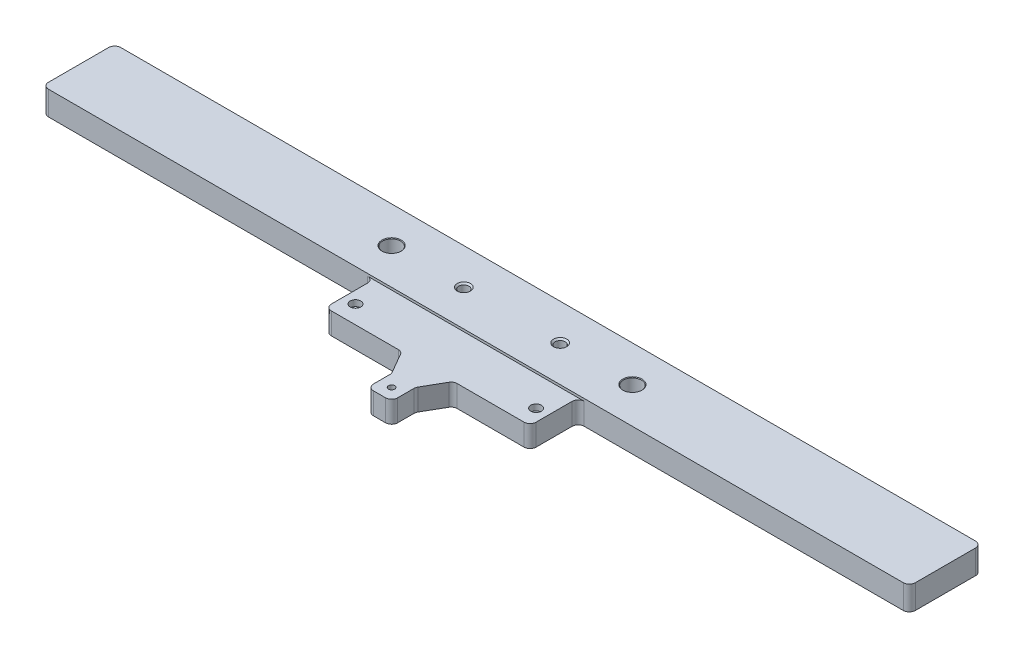
from build123d import *

# Parameters (mm, degrees)
SKETCH1_W                                        = 914.4
SKETCH1_H                                        = 76.2
BOSS_EXTRUDE1_DEPTH                              = 25.4
FILLET1_R                                        = 6.35
F_3_4_0_7500_DOWEL_HOLE1_D                       = 19.05
F_3_4_0_7500_DOWEL_HOLE1_CSINK_D                 = 20.32
F_3_4_0_7500_DOWEL_HOLE1_CSINK_ANGLE             = 90
BOSS_EXTRUDE2_DEPTH                              = 22.86
FILLET2_R                                        = 6.35
F_5_16_18_TAPPED_HOLE1_D                         = 6.5278
F_1_2_13_TAPPED_HOLE1_D                          = 10.71626
F_1_2_13_TAPPED_HOLE1_CSINK_D                    = 13.97
F_1_2_13_TAPPED_HOLE1_CSINK_ANGLE                = 90
CBORE_FOR_1_4_SOCKET_HEAD_CAP_SCREW1_D           = 6.7564
CBORE_FOR_1_4_SOCKET_HEAD_CAP_SCREW1_CBORE_D     = 11.1125
CBORE_FOR_1_4_SOCKET_HEAD_CAP_SCREW1_CBORE_DEPTH = 6.35


with BuildPart() as part:
    # Sketch1 → Boss-Extrude1 (new body)
    with BuildSketch(Plane(origin=(0, 0, 0), x_dir=(1, 0, 0), z_dir=(0, 1, 0))):
        Rectangle(SKETCH1_W, SKETCH1_H)
    extrude(amount=BOSS_EXTRUDE1_DEPTH)

    # Fillet1
    fillet1_edges = [part.edges().sort_by_distance(p)[0] for p in [
        (457.2, 12.7, 38.1),
        (-457.2, 12.7, 38.1),
        (-457.2, 12.7, -38.1),
        (457.2, 12.7, -38.1),
    ]]
    fillet(fillet1_edges, radius=FILLET1_R)

    # 3/4 (0.7500) Dowel Hole1 (through all)
    with Locations(Plane(origin=(0, 25.4, 0), x_dir=(1, 0, 0), z_dir=(0, 1, 0))):
        with Locations((-127, 0), (127, 0)):
            CounterSinkHole(F_3_4_0_7500_DOWEL_HOLE1_D / 2, F_3_4_0_7500_DOWEL_HOLE1_CSINK_D / 2, counter_sink_angle=F_3_4_0_7500_DOWEL_HOLE1_CSINK_ANGLE)

    # Sketch7 → Boss-Extrude2 (add)
    with BuildSketch(Plane(origin=(0, 0, 0), x_dir=(1, 0, 0), z_dir=(0, 1, 0))):
        Polygon((-27.364696837, -88.9), (-12.7, -114.3), (-12.7, -139.7), (12.7, -139.7), (12.7, -114.3), (27.364696837, -88.9), (107.95, -88.9), (107.95, -38.1), (-107.95, -38.1), (-107.95, -88.9), align=None)
    extrude(amount=BOSS_EXTRUDE2_DEPTH)

    # Fillet2
    fillet2_edges = [part.edges().sort_by_distance(p)[0] for p in [
        (107.95, 11.43, 88.9),
        (107.95, 11.43, 38.1),
        (-107.95, 11.43, 38.1),
        (-107.95, 11.43, 88.9),
        (-27.364696837, 11.43, 88.9),
        (-12.7, 11.43, 114.3),
        (-12.7, 11.43, 139.7),
        (12.7, 11.43, 139.7),
        (12.7, 11.43, 114.3),
        (27.364696837, 11.43, 88.9),
    ]]
    fillet(fillet2_edges, radius=FILLET2_R)

    # 5/16-18 Tapped Hole1 (through all)
    with Locations(Plane(origin=(0, 0, 0), x_dir=(-1, 0, 0), z_dir=(0, -1, 0))):
        with Locations((0, -127)):
            Hole(F_5_16_18_TAPPED_HOLE1_D / 2)

    # 1/2-13 Tapped Hole1 (through all)
    with Locations(Plane(origin=(0, 25.4, 0), x_dir=(1, 0, 0), z_dir=(0, 1, 0))):
        with Locations((-50.8, 0), (50.8, 0)):
            CounterSinkHole(F_1_2_13_TAPPED_HOLE1_D / 2, F_1_2_13_TAPPED_HOLE1_CSINK_D / 2, counter_sink_angle=F_1_2_13_TAPPED_HOLE1_CSINK_ANGLE)

    # CBORE for 1/4 Socket Head Cap Screw1 (through all)
    with Locations(Plane(origin=(0, 22.86, 0), x_dir=(1, 0, 0), z_dir=(0, 1, 0))):
        with Locations((-95.25, -69.85), (95.25, -69.85)):
            CounterBoreHole(CBORE_FOR_1_4_SOCKET_HEAD_CAP_SCREW1_D / 2, CBORE_FOR_1_4_SOCKET_HEAD_CAP_SCREW1_CBORE_D / 2, CBORE_FOR_1_4_SOCKET_HEAD_CAP_SCREW1_CBORE_DEPTH)


solid = part.part
